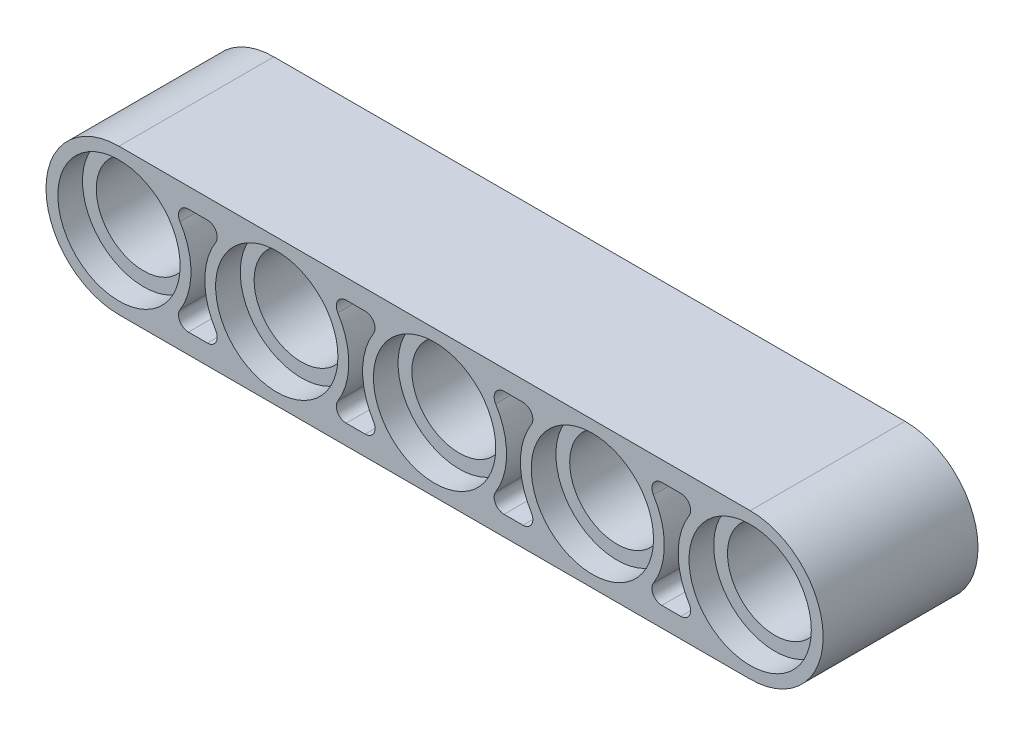
from build123d import *

# Parameters (mm, degrees)
SKETCH1_R            = 2.4
BEAM_DEPTH           = 3.925
SKETCH3_R            = 3.1
HOLE_SURROUND_DEPTH  = 1.25
CAVITY_CUT_DEPTH     = 3
FILLET2_R            = 0.5
FILLET2_OF_MIRROR2_R = 0.5


with BuildPart() as part:
    # Sketch1 → Beam (new, symmetric)
    with BuildSketch(Plane.XY):
        with BuildLine():
            Line((32, 3.7), (0, 3.7))
            ThreePointArc((0, 3.7), (-3.7, 0), (0, -3.7))
            Line((0, -3.7), (32, -3.7))
            ThreePointArc((32, -3.7), (35.7, 0), (32, 3.7))
        make_face()
        Circle(SKETCH1_R, mode=Mode.SUBTRACT)
        with Locations((8, 0)):
            Circle(SKETCH1_R, mode=Mode.SUBTRACT)
        with Locations((16, 0)):
            Circle(SKETCH1_R, mode=Mode.SUBTRACT)
        with Locations((24, 0)):
            Circle(SKETCH1_R, mode=Mode.SUBTRACT)
        with Locations((32, 0)):
            Circle(SKETCH1_R, mode=Mode.SUBTRACT)
    extrude(amount=BEAM_DEPTH, both=True)

    # Sketch3 → Hole Surround (cut)
    with BuildSketch(Plane.XY.offset(3.925)):
        with Locations((32, 0)):
            Circle(SKETCH3_R)
        with Locations((24, 0)):
            Circle(SKETCH3_R)
        with Locations((16, 0)):
            Circle(SKETCH3_R)
        with Locations((8, 0)):
            Circle(SKETCH3_R)
        Circle(SKETCH3_R)
    hole_surround = extrude(amount=-HOLE_SURROUND_DEPTH, mode=Mode.SUBTRACT)

    # Sketch4 → Cavity Cut (cut)
    with BuildSketch(Plane.XY.offset(3.925)):
        with BuildLine():
            ThreePointArc((2.456114818, 2.7), (3.65, 0), (2.456114818, -2.7))
            Line((2.456114818, -2.7), (5.543885182, -2.7))
            ThreePointArc((5.543885182, -2.7), (4.35, 0), (5.543885182, 2.7))
            Line((5.543885182, 2.7), (2.456114818, 2.7))
        make_face()
        with BuildLine():
            ThreePointArc((10.456114818, 2.7), (11.65, 0), (10.456114818, -2.7))
            Line((10.456114818, -2.7), (13.543885182, -2.7))
            ThreePointArc((13.543885182, -2.7), (12.35, 0), (13.543885182, 2.7))
            Line((13.543885182, 2.7), (10.456114818, 2.7))
        make_face()
        with BuildLine():
            ThreePointArc((18.456114818, 2.7), (19.65, 0), (18.456114818, -2.7))
            Line((18.456114818, -2.7), (21.543885182, -2.7))
            ThreePointArc((21.543885182, -2.7), (20.35, 0), (21.543885182, 2.7))
            Line((21.543885182, 2.7), (18.456114818, 2.7))
        make_face()
        with BuildLine():
            ThreePointArc((26.456114818, 2.7), (27.65, 0), (26.456114818, -2.7))
            Line((26.456114818, -2.7), (29.543885182, -2.7))
            ThreePointArc((29.543885182, -2.7), (28.35, 0), (29.543885182, 2.7))
            Line((29.543885182, 2.7), (26.456114818, 2.7))
        make_face()
    cavity_cut = extrude(amount=-CAVITY_CUT_DEPTH, mode=Mode.SUBTRACT)

    # Fillet2
    fillet2_edges = [part.edges().sort_by_distance(p)[0] for p in [
        (29.543885182, 2.7, 2.425),
        (29.543885182, -2.7, 2.425),
        (26.456114818, 2.7, 2.425),
        (26.456114818, -2.7, 2.425),
        (21.543885182, 2.7, 2.425),
        (18.456114818, 2.7, 2.425),
        (18.456114818, -2.7, 2.425),
        (21.543885182, -2.7, 2.425),
        (13.543885182, -2.7, 2.425),
        (10.456114818, -2.7, 2.425),
        (13.543885182, 2.7, 2.425),
        (10.456114818, 2.7, 2.425),
        (5.543885182, -2.7, 2.425),
        (5.543885182, 2.7, 2.425),
        (2.456114818, -2.7, 2.425),
        (2.456114818, 2.7, 2.425),
    ]]
    fillet(fillet2_edges, radius=FILLET2_R)

    # Mirror2: Hole Surround, Cavity Cut across plane
    add(hole_surround.mirror(Plane.XY), mode=Mode.SUBTRACT)
    add(cavity_cut.mirror(Plane.XY), mode=Mode.SUBTRACT)

    # Fillet2 of Mirror2
    fillet2_of_mirror2_edges = [part.edges().sort_by_distance(p)[0] for p in [
        (29.543885182, 2.7, -2.425),
        (29.543885182, -2.7, -2.425),
        (26.456114818, 2.7, -2.425),
        (26.456114818, -2.7, -2.425),
        (21.543885182, 2.7, -2.425),
        (18.456114818, 2.7, -2.425),
        (18.456114818, -2.7, -2.425),
        (21.543885182, -2.7, -2.425),
        (13.543885182, -2.7, -2.425),
        (10.456114818, -2.7, -2.425),
        (13.543885182, 2.7, -2.425),
        (10.456114818, 2.7, -2.425),
        (5.543885182, -2.7, -2.425),
        (5.543885182, 2.7, -2.425),
        (2.456114818, -2.7, -2.425),
        (2.456114818, 2.7, -2.425),
    ]]
    fillet(fillet2_of_mirror2_edges, radius=FILLET2_OF_MIRROR2_R)


solid = part.part
